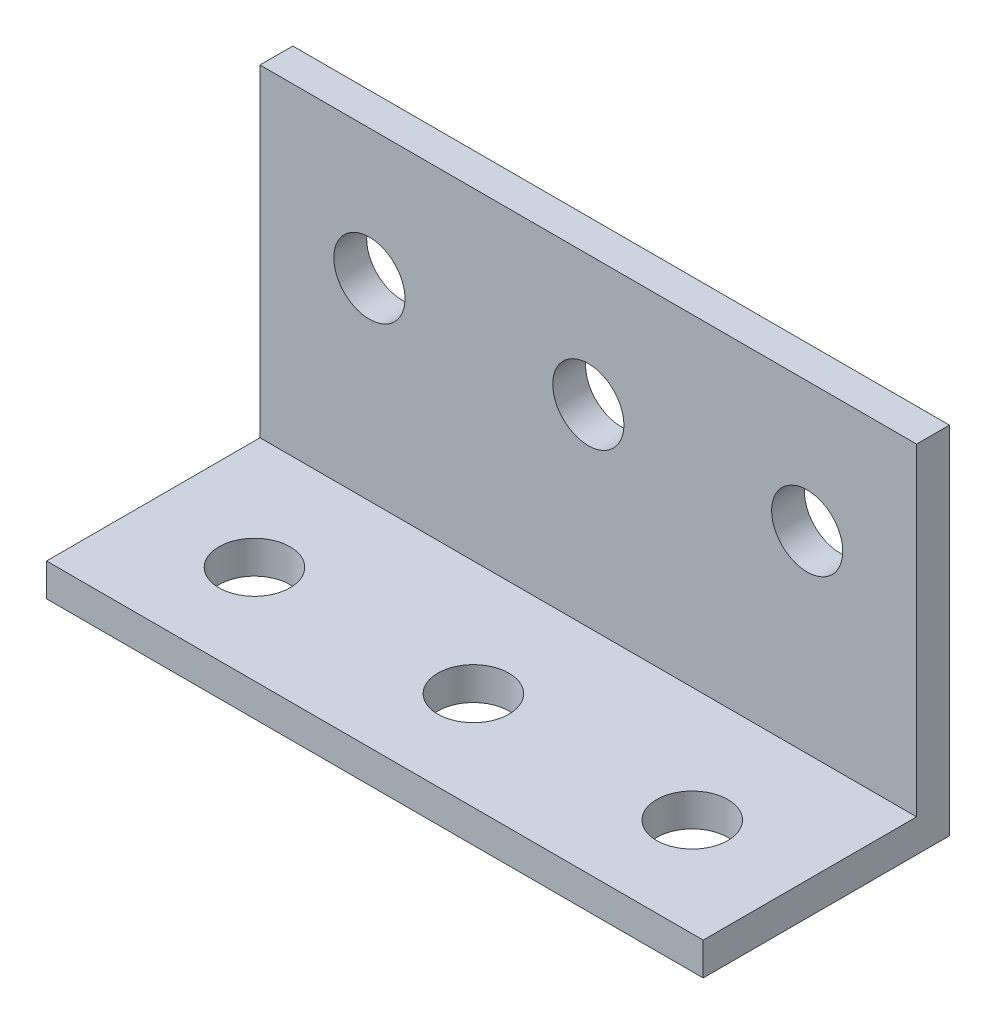
from build123d import *

# Parameters (mm, degrees)
SKETCH_1_W             = 240
SKETCH_1_H             = 130
EXTRUDE_1_DEPTH        = 90
SKETCH_2_W             = 78
SKETCH_2_H             = 118
CUT_EXTRUDE_1_DEPTH    = 288.402157264
SKETCH_3_R             = 13
CUT_EXTRUDE_2_DEPTH    = 288.402157264
PATTERN_LINEAR_1_COUNT = 3
PATTERN_LINEAR_1_PITCH = 80
SKETCH_4_R             = 13
CUT_EXTRUDE_3_DEPTH    = 288.402157264
PATTERN_LINEAR_2_COUNT = 3
PATTERN_LINEAR_2_PITCH = 80


with BuildPart() as part:
    # 草图1 → 凸台-拉伸1 (new body)
    with BuildSketch(Plane.XY):
        with Locations((120, 65)):
            Rectangle(SKETCH_1_W, SKETCH_1_H)
    extrude(amount=EXTRUDE_1_DEPTH)

    # 草图2 → 切除-拉伸1 (cut, through all)
    with BuildSketch(Plane.ZY):
        with Locations((51, 71)):
            Rectangle(SKETCH_2_W, SKETCH_2_H)
    extrude(amount=-CUT_EXTRUDE_1_DEPTH, mode=Mode.SUBTRACT)

    # 草图3 → 切除-拉伸2 (cut, through all)
    with BuildSketch(Plane(origin=(0, 0, 0), x_dir=(-1, 0, 0), z_dir=(0, 0, -1))):
        with Locations((-200, 82.5)):
            Circle(SKETCH_3_R)
    cut_extrude_2 = extrude(amount=-CUT_EXTRUDE_2_DEPTH, mode=Mode.SUBTRACT)

    # 阵列(线性)1: 切除-拉伸2 ×3
    with Locations(*[(-i * PATTERN_LINEAR_1_PITCH, 0, 0) for i in range(1, PATTERN_LINEAR_1_COUNT)]):
        add(cut_extrude_2, mode=Mode.SUBTRACT)

    # 草图4 → 切除-拉伸3 (cut, through all)
    with BuildSketch(Plane.XZ):
        with Locations(Location((40, 54, 0), (0, 0, 270))):
            Circle(SKETCH_4_R)
    cut_extrude_3 = extrude(amount=-CUT_EXTRUDE_3_DEPTH, mode=Mode.SUBTRACT)

    # 阵列(线性)2: 切除-拉伸3 ×3
    with Locations(*[(i * PATTERN_LINEAR_2_PITCH, 0, 0) for i in range(1, PATTERN_LINEAR_2_COUNT)]):
        add(cut_extrude_3, mode=Mode.SUBTRACT)


solid = part.part
